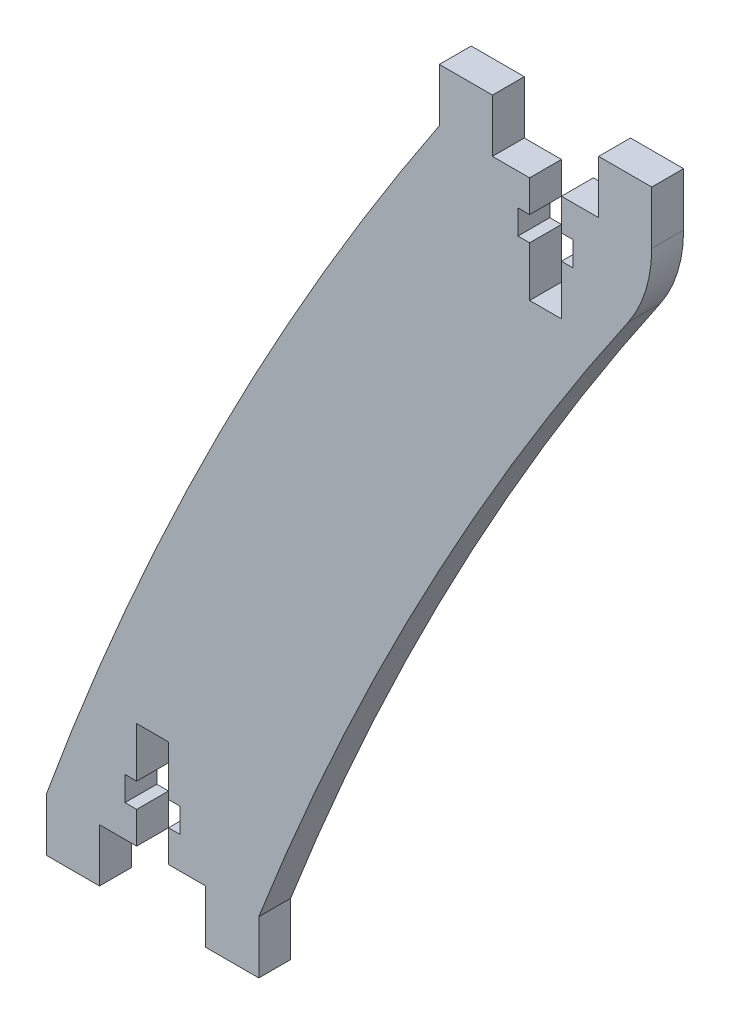
from build123d import *

# Parameters (mm, degrees)
BOSS_EXTRUDE1_DEPTH = 3


with BuildPart() as part:
    # Sketch1 → Boss-Extrude1 (new body)
    with BuildSketch(Plane.XY):
        with BuildLine():
            Line((61.5, 73), (65, 73))
            Line((65, 73), (65, 78))
            Line((65, 78), (70, 78))
            Line((70, 78), (70, 73))
            ThreePointArc((70, 73), (69.43599305, 69.277443256), (67.794598243, 65.88902834))
            ThreePointArc((67.794598243, 65.88902834), (48.490808127, 33.951291624), (33, 0))
            Line((33, 0), (33, -5))
            Line((33, -5), (28, -5))
            Line((28, -5), (28, 0))
            Line((28, 0), (24.5, 0))
            Line((24.5, 0), (24.5, 3))
            Line((24.5, 3), (25.6, 3))
            Line((25.6, 3), (25.6, 5.3))
            Line((25.6, 5.3), (24.5, 5.3))
            Line((24.5, 5.3), (24.5, 10))
            Line((24.5, 10), (21.5, 10))
            Line((21.5, 10), (21.5, 5.3))
            Line((21.5, 5.3), (20.4, 5.3))
            Line((20.4, 5.3), (20.4, 3))
            Line((20.4, 3), (21.5, 3))
            Line((21.5, 3), (21.5, 0))
            Line((21.5, 0), (18, 0))
            Line((18, 0), (18, -5))
            Line((18, -5), (13, -5))
            Line((13, -5), (13, 0))
            ThreePointArc((13, 0), (29.306522289, 37.611762675), (50, 73))
            Line((50, 73), (50, 78))
            Line((50, 78), (55, 78))
            Line((55, 78), (55, 73))
            Line((55, 73), (58.5, 73))
            Line((58.5, 73), (58.5, 70))
            Line((58.5, 70), (57.4, 70))
            Line((57.4, 70), (57.4, 67.7))
            Line((57.4, 67.7), (58.5, 67.7))
            Line((58.5, 67.7), (58.5, 63))
            Line((58.5, 63), (61.5, 63))
            Line((61.5, 63), (61.5, 67.7))
            Line((61.5, 67.7), (62.6, 67.7))
            Line((62.6, 67.7), (62.6, 70))
            Line((62.6, 70), (61.5, 70))
            Line((61.5, 70), (61.5, 73))
        make_face()
    extrude(amount=BOSS_EXTRUDE1_DEPTH)


solid = part.part
